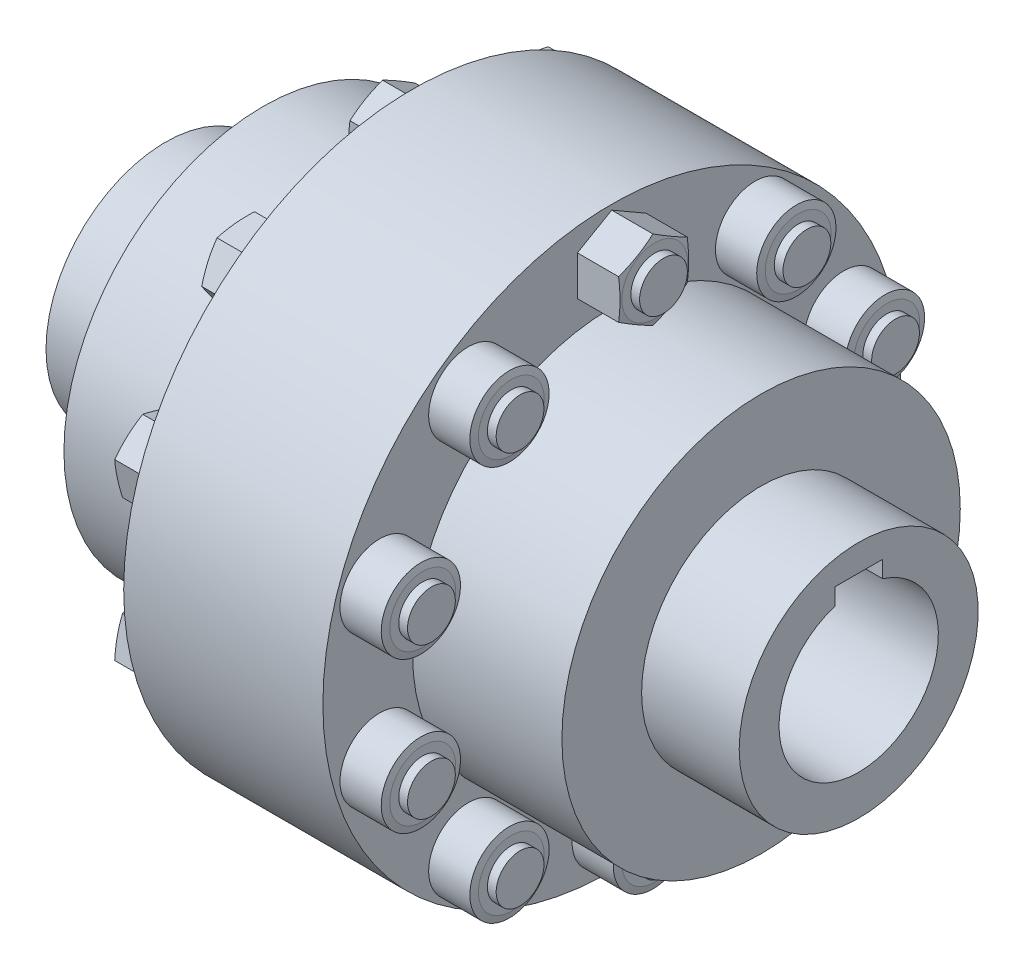
from build123d import *

# Parameters (mm, degrees)
SKETCH_1_W               = 25.5
SKETCH_1_H               = 15
CUT_EXTRUDE_1_DEPTH      = 135.467468185
CUT_EXTRUDE_1_DEPTH_BACK = 135.467468185
SKETCH_3_W               = 12
SKETCH_3_H               = 23.3
CUT_EXTRUDE_2_DEPTH      = 8
CUT_EXTRUDE_START        = -10.8
CUT_EXTRUDE_3_DEPTH      = 10.8
PATTERN_CIRCULAR_1_COUNT = 10


with BuildPart() as part:
    # Эскиз1 → Повернуть1 (revolve)
    with BuildSketch(Plane.XY, mode=Mode.PRIVATE) as revolve_1_sk:
        Polygon((-87, 20), (-87, 30), (-62.5, 30), (-62.5, 50), (-25, 50), (-25, 72.5), (25, 72.5), (25, 50), (62.5, 50), (62.5, 30), (87, 30), (87, 20), (5, 20), (5, 30), (24, 30), (24, 45), (-24, 45), (-24, 30), (-5, 30), (-5, 20), align=None)
        with Locations((-48.75, 37.5)):
            Rectangle(SKETCH_1_W, SKETCH_1_H, mode=Mode.SUBTRACT)
        with Locations((48.75, 37.5)):
            Rectangle(SKETCH_1_W, SKETCH_1_H, mode=Mode.SUBTRACT)
    revolve(revolve_1_sk.sketch.rotate(Axis((-98.607085032, 0, 0), (1, 0, 0)), 90), axis=Axis((-98.607085032, 0, 0), (1, 0, 0)))

    # Эскиз3 → Вырез-Вытянуть1 (cut, two sides: drawn at the far end of the back side and taken through both)
    with BuildSketch(Plane(origin=(0, 0, 0), x_dir=(0, 0, -1), z_dir=(1, 0, 0)).offset(-CUT_EXTRUDE_1_DEPTH_BACK)):
        with Locations((0, 11.65)):
            Rectangle(SKETCH_3_W, SKETCH_3_H)
    extrude(amount=CUT_EXTRUDE_1_DEPTH + CUT_EXTRUDE_1_DEPTH_BACK, mode=Mode.SUBTRACT)

    # Эскиз2 → Повернуть2 (revolve)
    with BuildSketch(Plane.XY, mode=Mode.PRIVATE) as revolve_2_sk:
        Polygon((-33, 61.25), (38, 61.25), (38, 67.25), (35.8, 67.25), (35.8, 69.5), (35.344486373, 71.2), (25, 71.2), (25, 67.25), (-25, 67.25), (-25, 70.7), (-32.517691454, 70.7), (-33, 68.9), align=None)
    revolve_2 = revolve(revolve_2_sk.sketch.rotate(Axis((-33, 61.25, 0), (1, 0, 0)), 90), axis=Axis((-33, 61.25, 0), (1, 0, 0)))

    # Эскиз5 → Вырез-Вытянуть2 (cut)
    with BuildSketch(Plane.ZY.offset(33)):
        with BuildLine():
            Line((-8.183940066, 65.975), (0, 70.7))
            ThreePointArc((0, 70.7), (-4.725, 69.433940066), (-8.183940066, 65.975))
        make_face()
        with BuildLine():
            ThreePointArc((8.183940066, 65.975), (4.725, 69.433940066), (0, 70.7))
            Line((0, 70.7), (8.183940066, 65.975))
        make_face()
        with BuildLine():
            Line((-8.183940066, 56.525), (-8.183940066, 65.975))
            ThreePointArc((-8.183940066, 65.975), (-9.45, 61.25), (-8.183940066, 56.525))
        make_face()
        with BuildLine():
            Line((0, 51.8), (-8.183940066, 56.525))
            ThreePointArc((-8.183940066, 56.525), (-4.725, 53.066059934), (0, 51.8))
        make_face()
        with BuildLine():
            ThreePointArc((0, 51.8), (4.725, 53.066059934), (8.183940066, 56.525))
            Line((8.183940066, 56.525), (0, 51.8))
        make_face()
        with BuildLine():
            ThreePointArc((9.45, 61.25), (9.127999058, 63.695839976), (8.183940066, 65.975))
            Line((8.183940066, 65.975), (8.183940066, 56.525))
            ThreePointArc((8.183940066, 56.525), (9.127999058, 58.804160024), (9.45, 61.25))
        make_face()
    cut_extrude_2 = extrude(amount=-CUT_EXTRUDE_2_DEPTH, mode=Mode.SUBTRACT)

    # Эскиз6 → Вырез-Вытянуть3 (cut)
    with BuildSketch(Plane(origin=(35.8, 0, 0), x_dir=(0, 0, -1), z_dir=(1, 0, 0)).offset(CUT_EXTRUDE_START)):
        with BuildLine():
            Line((-8.616952768, 66.225), (0, 71.2))
            ThreePointArc((0, 71.2), (-4.975, 69.866952768), (-8.616952768, 66.225))
        make_face()
        with BuildLine():
            ThreePointArc((8.616952768, 66.225), (4.975, 69.866952768), (0, 71.2))
            Line((0, 71.2), (8.616952768, 66.225))
        make_face()
        with BuildLine():
            Line((-8.616952768, 56.275), (-8.616952768, 66.225))
            ThreePointArc((-8.616952768, 66.225), (-9.95, 61.25), (-8.616952768, 56.275))
        make_face()
        with BuildLine():
            Line((0, 51.3), (-8.616952768, 56.275))
            ThreePointArc((-8.616952768, 56.275), (-4.975, 52.633047232), (0, 51.3))
        make_face()
        with BuildLine():
            ThreePointArc((0, 51.3), (4.975, 52.633047232), (8.616952768, 56.275))
            Line((8.616952768, 56.275), (0, 51.3))
        make_face()
        with BuildLine():
            ThreePointArc((9.95, 61.25), (9.610961972, 63.825249499), (8.616952768, 66.225))
            Line((8.616952768, 66.225), (8.616952768, 56.275))
            ThreePointArc((8.616952768, 56.275), (9.610961972, 58.674750501), (9.95, 61.25))
        make_face()
    extrude(amount=CUT_EXTRUDE_3_DEPTH, mode=Mode.SUBTRACT)

    # Круговой массив1: Повернуть2, Вырез-Вытянуть2 ×10 about axis
    pattern_circular_1_axis = Axis((0, 0, 0), (1, 0, 0))
    add([revolve_2.rotate(pattern_circular_1_axis, i * 360 / PATTERN_CIRCULAR_1_COUNT) for i in range(1, PATTERN_CIRCULAR_1_COUNT)])
    add([cut_extrude_2.rotate(pattern_circular_1_axis, i * 360 / PATTERN_CIRCULAR_1_COUNT) for i in range(1, PATTERN_CIRCULAR_1_COUNT)], mode=Mode.SUBTRACT)


solid = part.part
